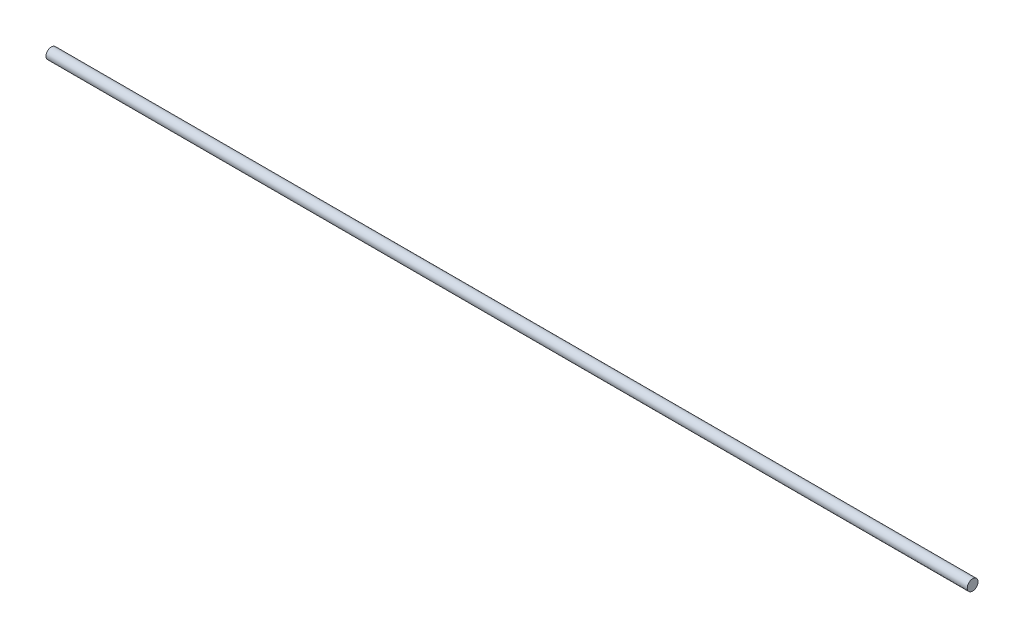
from build123d import *

# Parameters (mm, degrees)
SKETCH1_R           = 3.565
BOSS_EXTRUDE1_DEPTH = 609.6


with BuildPart() as part:
    # Sketch1 → Boss-Extrude1 (new body)
    with BuildSketch(Plane(origin=(0, 0, 0), x_dir=(0, 0, -1), z_dir=(1, 0, 0))):
        with Locations(Location((0, 0, 0), (0, 0, 180))):
            Circle(SKETCH1_R)
    extrude(amount=BOSS_EXTRUDE1_DEPTH)


solid = part.part
